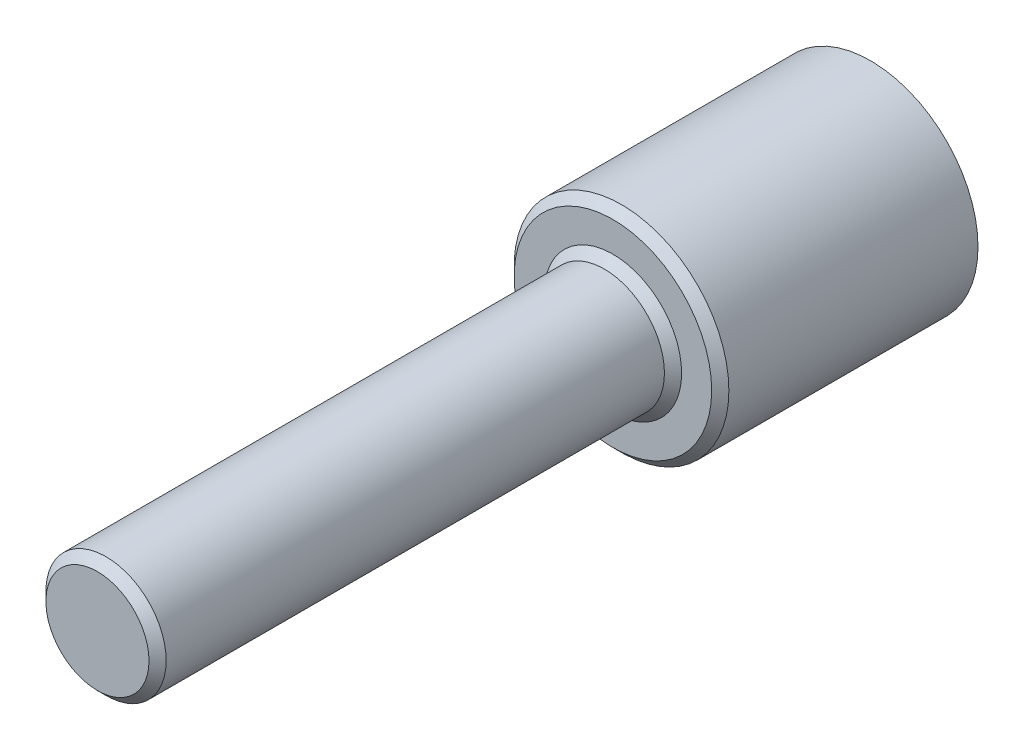
from build123d import *

# Parameters (mm, degrees)
SKETCH1_R           = 3.96875
BOSS_EXTRUDE1_DEPTH = 28.575
CUT_EXTRUDE1_START  = -19.05
SKETCH2_R           = 3.96875
SKETCH2_R_2         = 2.2225
CUT_EXTRUDE1_DEPTH  = 19.05
SKETCH3_R           = 2.4892
CUT_EXTRUDE2_DEPTH  = 7.62
CHAMFER1_SIZE       = 0.3175


with BuildPart() as part:
    # Sketch1 → Boss-Extrude1 (new body)
    with BuildSketch(Plane.XY):
        Circle(SKETCH1_R)
    extrude(amount=BOSS_EXTRUDE1_DEPTH)

    # Sketch2 → Cut-Extrude1 (cut)
    with BuildSketch(Plane.XY.offset(28.575).offset(CUT_EXTRUDE1_START)):
        Circle(SKETCH2_R)
        Circle(SKETCH2_R_2, mode=Mode.SUBTRACT)
    extrude(amount=CUT_EXTRUDE1_DEPTH, mode=Mode.SUBTRACT)

    # Sketch3 → Cut-Extrude2 (cut)
    with BuildSketch(Plane(origin=(0, 0, 0), x_dir=(-1, 0, 0), z_dir=(0, 0, -1))):
        Circle(SKETCH3_R)
    extrude(amount=-CUT_EXTRUDE2_DEPTH, mode=Mode.SUBTRACT)

    # Chamfer1
    chamfer1_edges = [part.edges().sort_by_distance(p)[0] for p in [
        (-2.2225, 0, 28.575),
        (-3.96875, 0, 9.525),
        (-2.2225, 0, 9.525),
    ]]
    chamfer(chamfer1_edges, length=CHAMFER1_SIZE)


solid = part.part
